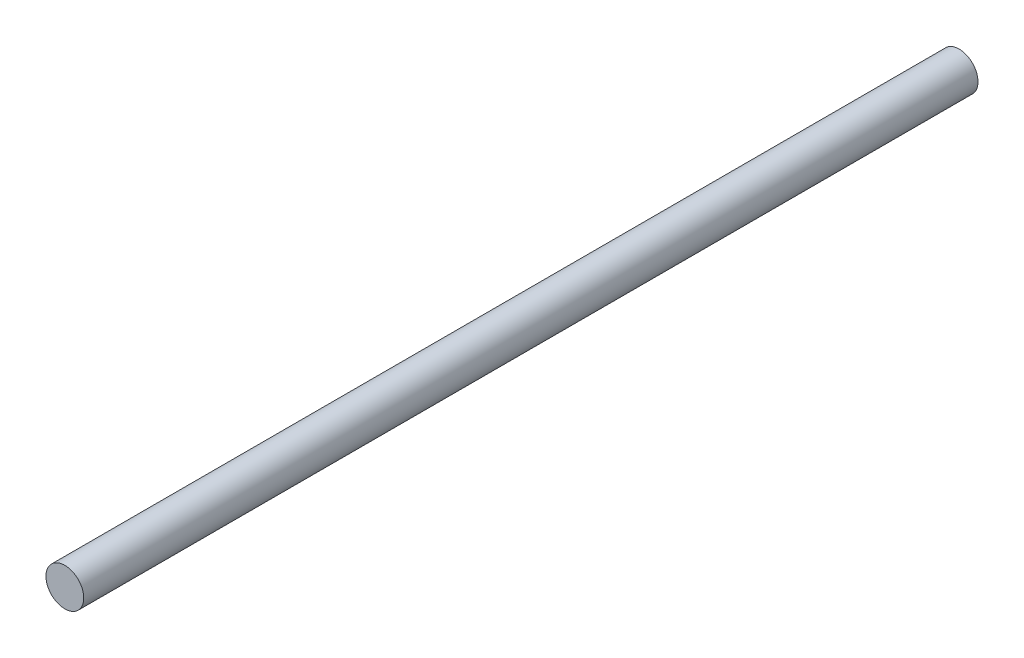
from build123d import *

# Parameters (mm, degrees)
SKETCH_1_R      = 3
EXTRUDE_1_DEPTH = 142


with BuildPart() as part:
    # 草图1 → 凸台-拉伸1 (new body)
    with BuildSketch(Plane.XY):
        Circle(SKETCH_1_R)
    extrude(amount=EXTRUDE_1_DEPTH)


solid = part.part
